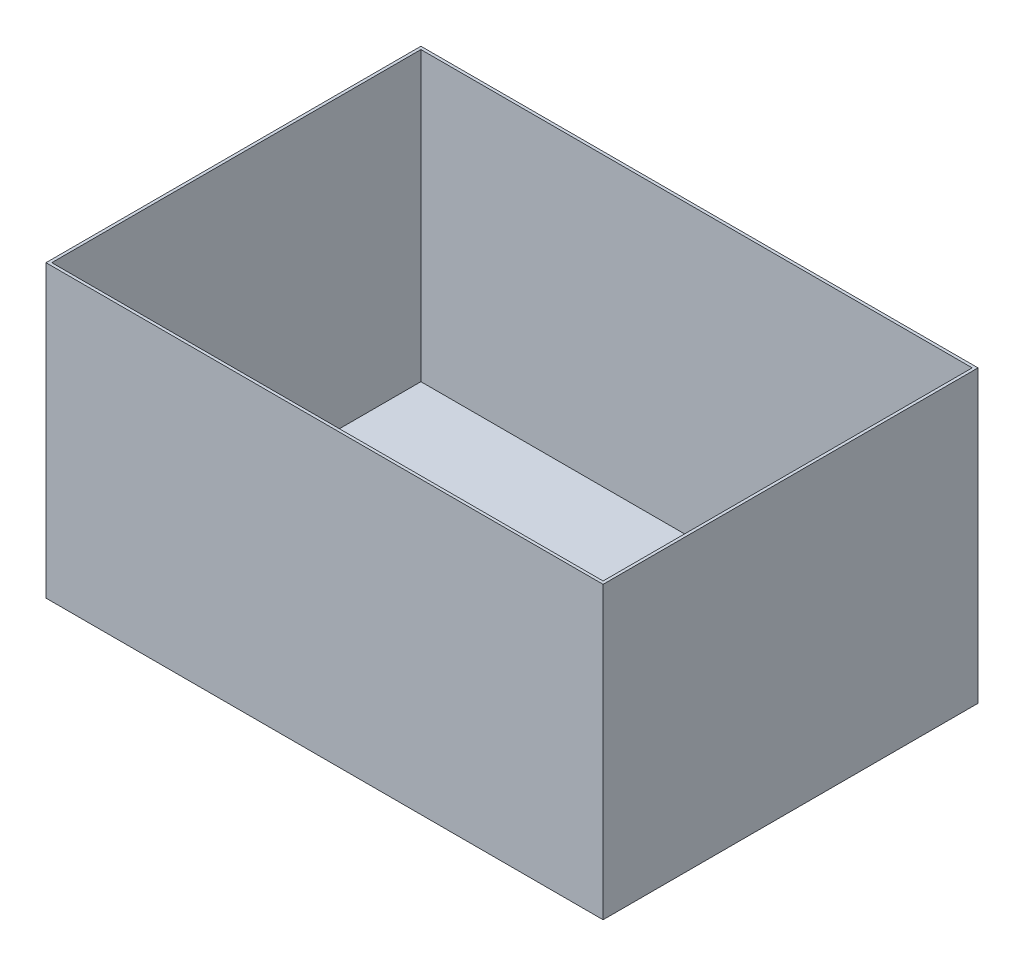
from build123d import *

# Parameters (mm, degrees)
SKETCH1_W           = 581
SKETCH1_H           = 391
BOSS_EXTRUDE1_DEPTH = 151.5
SHELL1_T            = -3


with BuildPart() as part:
    # Sketch1 → Boss-Extrude1 (new, symmetric)
    with BuildSketch(Plane(origin=(0, 0, 0), x_dir=(1, 0, 0), z_dir=(0, 1, 0))):
        Rectangle(SKETCH1_W, SKETCH1_H)
    extrude(amount=BOSS_EXTRUDE1_DEPTH, both=True)

    # Shell1
    shell1_openings = [part.faces().sort_by_distance(p)[0] for p in [
        (0, 151.5, 0),
    ]]
    offset(amount=SHELL1_T, openings=shell1_openings, kind=Kind.INTERSECTION)


solid = part.part
